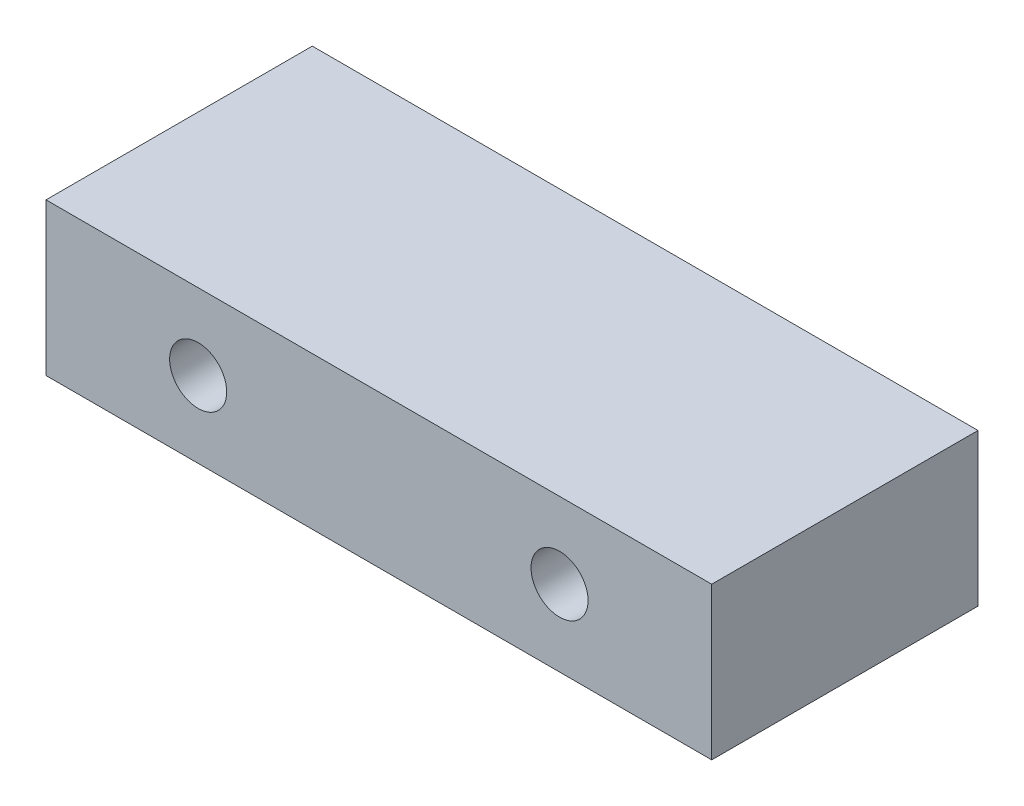
from build123d import *

# Parameters (mm, degrees)
SKETCH1_W           = 17.5
SKETCH1_H           = 4
BOSS_EXTRUDE1_DEPTH = 7
CUT_EXTRUDE1_REACH  = 13.383
SKETCH3_R           = 0.75


with BuildPart() as part:
    # Sketch1 → Boss-Extrude1 (new body)
    with BuildSketch(Plane.XY):
        Rectangle(SKETCH1_W, SKETCH1_H)
    extrude(amount=-BOSS_EXTRUDE1_DEPTH)

    # Sketch3 → Cut-Extrude1 (cut, up to next)
    with BuildSketch(Plane.XY, mode=Mode.PRIVATE) as cut_extrude1_sk1:
        with Locations((-4.75, 0)):
            Circle(SKETCH3_R)
    cut_extrude1_tool1 = extrude(cut_extrude1_sk1.sketch, amount=-CUT_EXTRUDE1_REACH, mode=Mode.PRIVATE) & part.part
    # Sketch3 → Cut-Extrude1 (cut, up to next)
    with BuildSketch(Plane.XY, mode=Mode.PRIVATE) as cut_extrude1_sk2:
        with Locations((4.75, 0)):
            Circle(SKETCH3_R)
    cut_extrude1_tool2 = extrude(cut_extrude1_sk2.sketch, amount=-CUT_EXTRUDE1_REACH, mode=Mode.PRIVATE) & part.part
    add(cut_extrude1_tool1.solids().sort_by_distance((-4.75, 0, 0))[0], mode=Mode.SUBTRACT)
    add(cut_extrude1_tool2.solids().sort_by_distance((4.75, 0, 0))[0], mode=Mode.SUBTRACT)


solid = part.part
